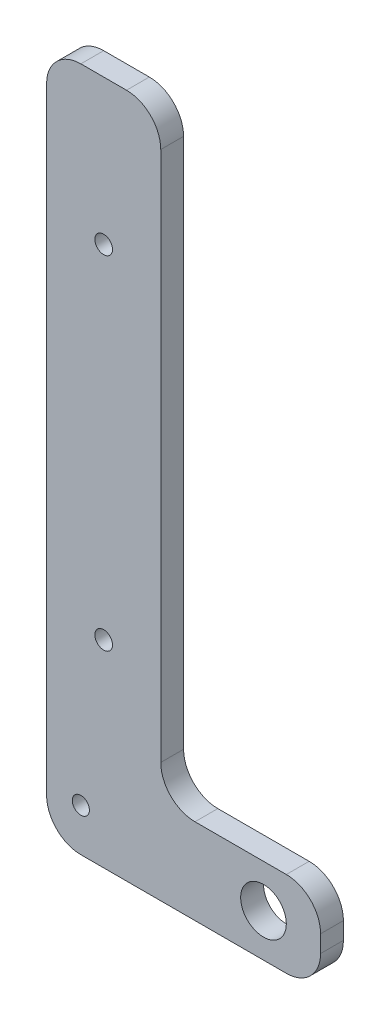
from build123d import *

# Parameters (mm, degrees)
SKETCH1_W           = 20
SKETCH1_H           = 105
SKETCH1_R           = 1.55
SKETCH1_H_2         = 15
SKETCH1_R_2         = 1.5
SKETCH1_W_2         = 28
SKETCH1_R_3         = 4
BOSS_EXTRUDE1_DEPTH = 2
FILLET1_R           = 6


with BuildPart() as part:
    # Sketch1 → Boss-Extrude1 (new, symmetric)
    # profile 1 of 3: a face of its own
    with BuildSketch(Plane.XY):
        with Locations((-14, 60)):
            Rectangle(SKETCH1_W, SKETCH1_H)
        with Locations((-14, 27.1)):
            Circle(SKETCH1_R, mode=Mode.SUBTRACT)
        with Locations((-14, 87.1)):
            Circle(SKETCH1_R, mode=Mode.SUBTRACT)
    # profile 2 of 3: a face of its own
    with BuildSketch(Plane.XY):
        with Locations((-14, 0)):
            Rectangle(SKETCH1_W, SKETCH1_H_2)
        with Locations((-18, 0)):
            Circle(SKETCH1_R_2, mode=Mode.SUBTRACT)
    # profile 3 of 3: a face of its own
    with BuildSketch(Plane.XY):
        with Locations((10, 0)):
            Rectangle(SKETCH1_W_2, SKETCH1_H_2)
        with Locations((14, 0)):
            Circle(SKETCH1_R_3, mode=Mode.SUBTRACT)
    extrude(amount=BOSS_EXTRUDE1_DEPTH, both=True)

    # Fillet1
    fillet1_edges = [part.edges().sort_by_distance(p)[0] for p in [
        (-24, 112.5, 0),
        (-4, 112.5, 0),
        (-4, 7.5, 0),
        (24, 7.5, 0),
        (24, -7.5, 0),
        (-24, -7.5, 0),
    ]]
    fillet(fillet1_edges, radius=FILLET1_R)


solid = part.part
